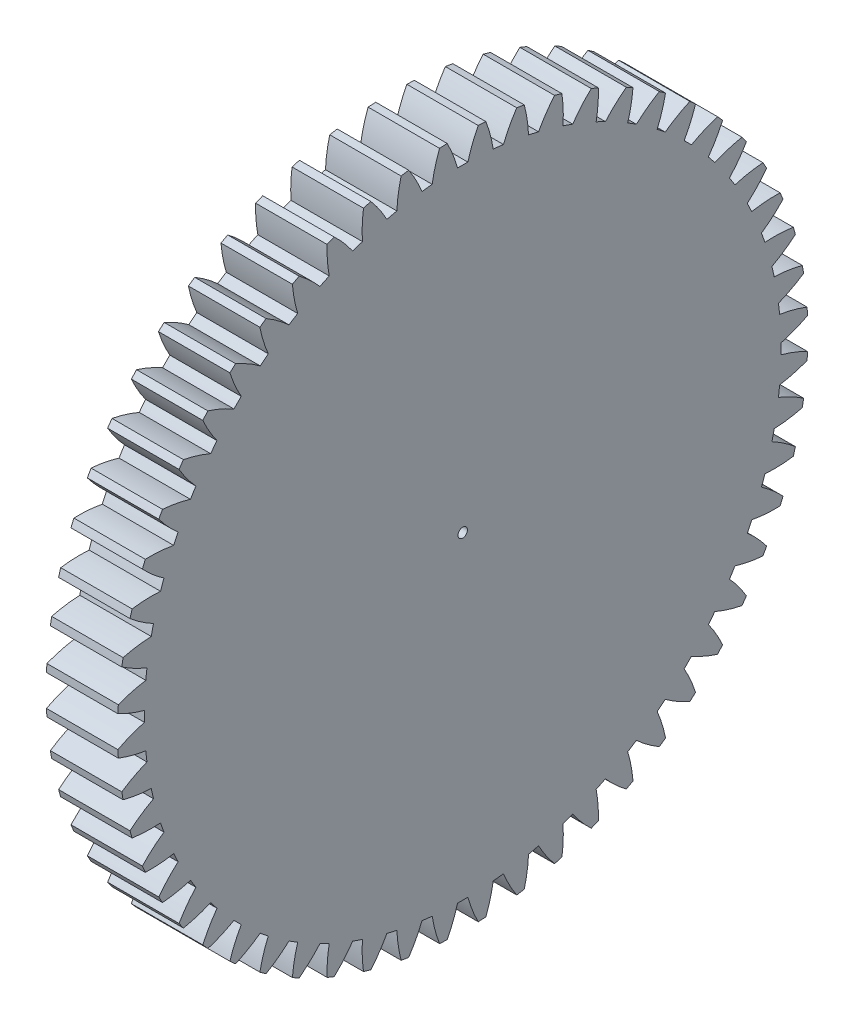
from build123d import *

# Parameters (mm, degrees)
BASPROSKE_W     = 6
BASPROSKE_H     = 29
TOOTHCUT_DEPTH  = 42.448763552
TEETHCUTS_COUNT = 56
TEETHCUTS_ANGLE = 353.571428571
BORSKE_R        = 0.4
BORE_DEPTH      = 50.0000508


with BuildPart() as part:
    # BasProSke → Base-Revolve (revolve)
    with BuildSketch(Plane(origin=(0, 0, 0), x_dir=(1, 0, 0), z_dir=(0, 1, 0)), mode=Mode.PRIVATE) as base_revolve_sk:
        with Locations((3, 14.5)):
            Rectangle(BASPROSKE_W, BASPROSKE_H)
    revolve(base_revolve_sk.sketch.rotate(Axis((-10, 0, 0), (1, 0, 0)), 180), axis=Axis((-10, 0, 0), (1, 0, 0)))

    # TooCutSke → ToothCut (cut, through all)
    with BuildSketch(Plane(origin=(0, 0, 0), x_dir=(0, 0, -1), z_dir=(1, 0, 0))):
        with BuildLine():
            ThreePointArc((0.432851033, 26.745497583), (0, 26.749), (-0.432851033, 26.745497583))
            ThreePointArc((-0.432851033, 26.745497583), (-0.814856418, 27.894439223), (-1.318655043, 28.995430572))
            ThreePointArc((-1.318655043, 28.995430572), (0, 29.0254), (1.318655043, 28.995430572))
            ThreePointArc((1.318655043, 28.995430572), (0.814856418, 27.894439223), (0.432851033, 26.745497583))
        make_face()
    toothcut = extrude(amount=TOOTHCUT_DEPTH, mode=Mode.SUBTRACT)

    # TeethCuts: ToothCut ×56 about axis
    teethcuts_axis = Axis((-10, 0, 0), (1, 0, 0))
    for i in range(1, TEETHCUTS_COUNT):
        add(toothcut.rotate(teethcuts_axis, i * TEETHCUTS_ANGLE / (TEETHCUTS_COUNT - 1)), mode=Mode.SUBTRACT)

    # BorSke → Bore (cut, symmetric)
    with BuildSketch(Plane(origin=(0, 0, 0), x_dir=(0, 0, -1), z_dir=(1, 0, 0))):
        with Locations(Location((0, 0, 0), (0, 0, 180))):
            Circle(BORSKE_R)
    extrude(amount=BORE_DEPTH, both=True, mode=Mode.SUBTRACT)


solid = part.part
